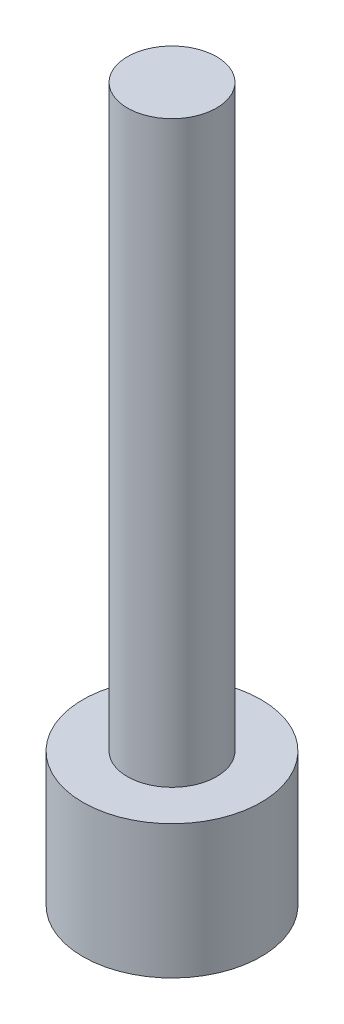
from build123d import *

# Parameters (mm, degrees)
SKETCH1_R           = 1
BOSS_EXTRUDE1_DEPTH = 13
SKETCH2_R           = 2
BOSS_EXTRUDE2_DEPTH = 3


with BuildPart() as part:
    # Sketch1 → Boss-Extrude1 (new body)
    with BuildSketch(Plane(origin=(0, 0, 0), x_dir=(1, 0, 0), z_dir=(0, 1, 0))):
        with Locations(Location((0, 0, 0), (0, 0, 90))):
            Circle(SKETCH1_R)
    extrude(amount=BOSS_EXTRUDE1_DEPTH)

    # Sketch2 → Boss-Extrude2 (add)
    with BuildSketch(Plane.XZ):
        with Locations(Location((0, 0, 0), (0, 0, 270))):
            Circle(SKETCH2_R)
    extrude(amount=BOSS_EXTRUDE2_DEPTH)


solid = part.part
